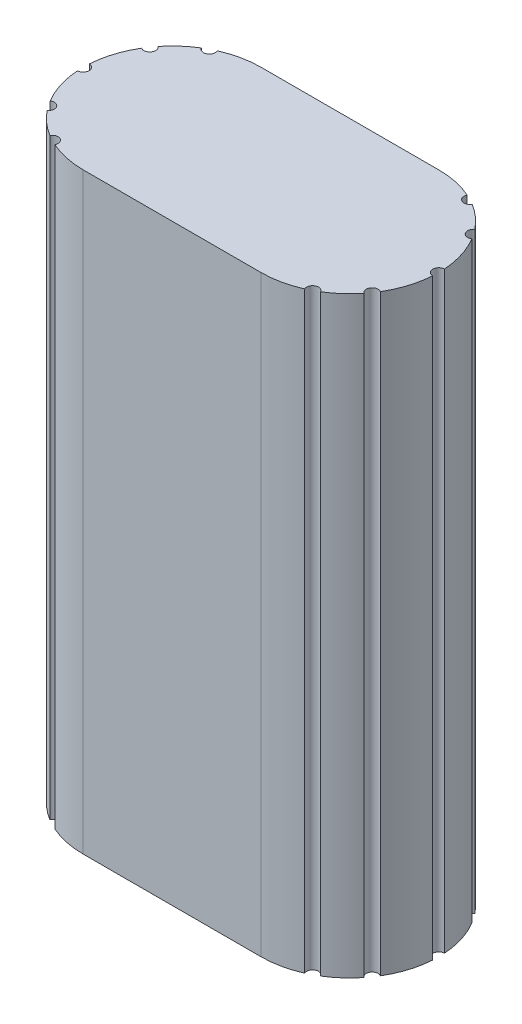
from build123d import *

# Parameters (mm, degrees)
BOSS_EXTRUDE1_DEPTH = 100
SKETCH2_R           = 1
CUT_EXTRUDE1_DEPTH  = 106.475115549


with BuildPart() as part:
    # Sketch1 → Boss-Extrude1 (new body)
    with BuildSketch(Plane(origin=(0, 0, 0), x_dir=(1, 0, 0), z_dir=(0, 1, 0))):
        with BuildLine():
            Line((15, -15), (-15, -15))
            ThreePointArc((-15, -15), (-30, 0), (-15, 15))
            Line((-15, 15), (15, 15))
            ThreePointArc((15, 15), (30, 0), (15, -15))
        make_face()
    extrude(amount=BOSS_EXTRUDE1_DEPTH)

    # Sketch2 → Cut-Extrude1 (cut, through all)
    with BuildSketch(Plane(origin=(0, 100, 0), x_dir=(1, 0, 0), z_dir=(0, 1, 0))):
        with Locations((-21.982299004, 13.275823915)):
            Circle(SKETCH2_R)
        with Locations((-30, 0)):
            Circle(SKETCH2_R)
        with Locations((-21.982299004, -13.275823915)):
            Circle(SKETCH2_R)
        with Locations((-27.321975393, 8.55388347)):
            Circle(SKETCH2_R)
        with Locations((-27.321975393, -8.55388347)):
            Circle(SKETCH2_R)
        with Locations((21.982299004, -13.275823915)):
            Circle(SKETCH2_R)
        with Locations((27.321975393, -8.55388347)):
            Circle(SKETCH2_R)
        with Locations((30, 0)):
            Circle(SKETCH2_R)
        with Locations((27.321975393, 8.55388347)):
            Circle(SKETCH2_R)
        with Locations((21.982299004, 13.275823915)):
            Circle(SKETCH2_R)
    extrude(amount=-CUT_EXTRUDE1_DEPTH, mode=Mode.SUBTRACT)


solid = part.part
